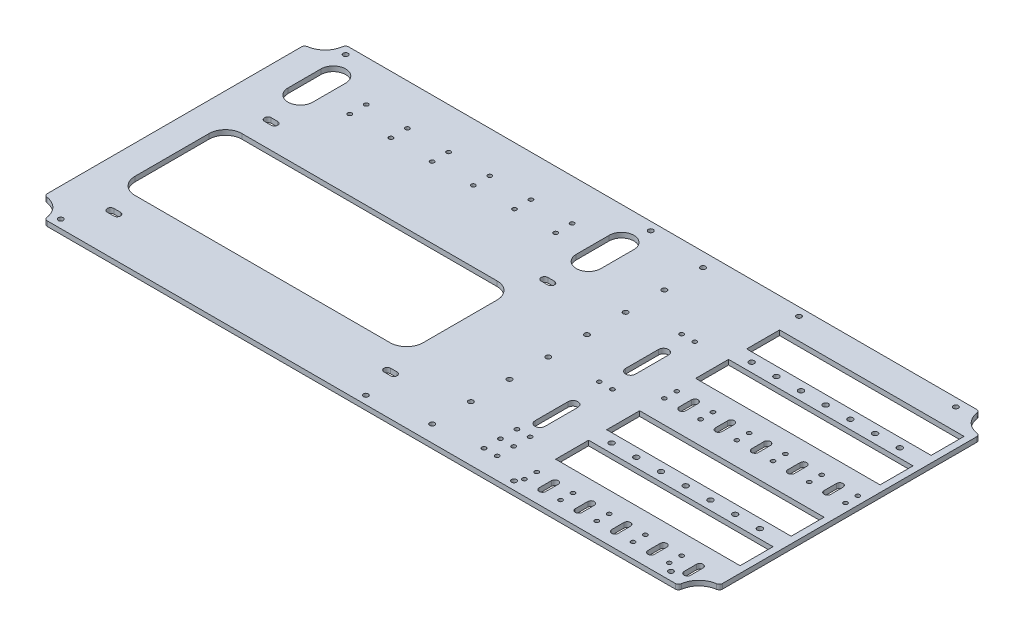
from build123d import *

# Parameters (mm, degrees)
BOSS_EXTRUDE1_DEPTH = 3
CUT_EXTRUDE1_REACH  = 450.997
SKETCH2_R           = 1.6
SKETCH2_W           = 112
SKETCH2_H           = 20
CUT_EXTRUDE2_REACH  = 450.997
SKETCH3_R           = 1.5
CUT_EXTRUDE3_REACH  = 450.997
SKETCH4_R           = 1.25
SKETCH8_R           = 1.25
CUT_EXTRUDE4_DEPTH  = 3
CUT_EXTRUDE5_REACH  = 450.997
SKETCH9_R           = 1.25
CUT_EXTRUDE6_REACH  = 450.997
SKETCH10_R          = 1.5
CUT_EXTRUDE7_REACH  = 450.997
CUT_EXTRUDE8_REACH  = 450.997


with BuildPart() as part:
    # Sketch1 → Boss-Extrude1 (new body)
    with BuildSketch(Plane(origin=(0, 0, 0), x_dir=(1, 0, 0), z_dir=(0, 1, 0))):
        with BuildLine():
            Line((0, 14.361406616), (0, 168.638593384))
            ThreePointArc((0, 168.638593384), (0.491403941, 169.951657712), (1.724137931, 170.619477055))
            ThreePointArc((1.724137931, 170.619477055), (8.838834765, 174.161165235), (12.380522945, 181.275862069))
            ThreePointArc((12.380522945, 181.275862069), (13.048342288, 182.508596059), (14.361406616, 183))
            Line((14.361406616, 183), (395.638593384, 183))
            ThreePointArc((395.638593384, 183), (396.951657712, 182.508596059), (397.619477055, 181.275862069))
            ThreePointArc((397.619477055, 181.275862069), (401.161165235, 174.161165235), (408.275862069, 170.619477055))
            ThreePointArc((408.275862069, 170.619477055), (409.508596059, 169.951657712), (410, 168.638593384))
            Line((410, 168.638593384), (410, 14.361406616))
            ThreePointArc((410, 14.361406616), (409.508596059, 13.048342288), (408.275862069, 12.380522945))
            ThreePointArc((408.275862069, 12.380522945), (401.161165235, 8.838834765), (397.619477055, 1.724137931))
            ThreePointArc((397.619477055, 1.724137931), (396.951657712, 0.491403941), (395.638593384, 0))
            Line((395.638593384, 0), (14.361406616, 0))
            ThreePointArc((14.361406616, 0), (13.048342288, 0.491403941), (12.380522945, 1.724137931))
            ThreePointArc((12.380522945, 1.724137931), (8.838834765, 8.838834765), (1.724137931, 12.380522945))
            ThreePointArc((1.724137931, 12.380522945), (0.491403941, 13.048342288), (0, 14.361406616))
        make_face()
    extrude(amount=BOSS_EXTRUDE1_DEPTH)

    # Sketch2 → Cut-Extrude1 (cut, up to next)
    with BuildSketch(Plane(origin=(0, 3, 0), x_dir=(1, 0, 0), z_dir=(0, 1, 0)), mode=Mode.PRIVATE) as cut_extrude1_sk1:
        with Locations(Location((302.5, 139.5, 0), (0, 0, 270))):
            Circle(SKETCH2_R)
    cut_extrude1_tool1 = extrude(cut_extrude1_sk1.sketch, amount=-CUT_EXTRUDE1_REACH, mode=Mode.PRIVATE) & part.part
    # Sketch2 → Cut-Extrude1 (cut, up to next)
    with BuildSketch(Plane(origin=(0, 3, 0), x_dir=(1, 0, 0), z_dir=(0, 1, 0)), mode=Mode.PRIVATE) as cut_extrude1_sk2:
        with Locations(Location((317.5, 139.5, 0), (0, 0, 270))):
            Circle(SKETCH2_R)
    cut_extrude1_tool2 = extrude(cut_extrude1_sk2.sketch, amount=-CUT_EXTRUDE1_REACH, mode=Mode.PRIVATE) & part.part
    # Sketch2 → Cut-Extrude1 (cut, up to next)
    with BuildSketch(Plane(origin=(0, 3, 0), x_dir=(1, 0, 0), z_dir=(0, 1, 0)), mode=Mode.PRIVATE) as cut_extrude1_sk3:
        with Locations(Location((332.5, 139.5, 0), (0, 0, 270))):
            Circle(SKETCH2_R)
    cut_extrude1_tool3 = extrude(cut_extrude1_sk3.sketch, amount=-CUT_EXTRUDE1_REACH, mode=Mode.PRIVATE) & part.part
    # Sketch2 → Cut-Extrude1 (cut, up to next)
    with BuildSketch(Plane(origin=(0, 3, 0), x_dir=(1, 0, 0), z_dir=(0, 1, 0)), mode=Mode.PRIVATE) as cut_extrude1_sk4:
        with Locations(Location((347.5, 139.5, 0), (0, 0, 270))):
            Circle(SKETCH2_R)
    cut_extrude1_tool4 = extrude(cut_extrude1_sk4.sketch, amount=-CUT_EXTRUDE1_REACH, mode=Mode.PRIVATE) & part.part
    # Sketch2 → Cut-Extrude1 (cut, up to next)
    with BuildSketch(Plane(origin=(0, 3, 0), x_dir=(1, 0, 0), z_dir=(0, 1, 0)), mode=Mode.PRIVATE) as cut_extrude1_sk5:
        with Locations(Location((362.5, 139.5, 0), (0, 0, 270))):
            Circle(SKETCH2_R)
    cut_extrude1_tool5 = extrude(cut_extrude1_sk5.sketch, amount=-CUT_EXTRUDE1_REACH, mode=Mode.PRIVATE) & part.part
    # Sketch2 → Cut-Extrude1 (cut, up to next)
    with BuildSketch(Plane(origin=(0, 3, 0), x_dir=(1, 0, 0), z_dir=(0, 1, 0)), mode=Mode.PRIVATE) as cut_extrude1_sk6:
        with Locations(Location((377.5, 139.5, 0), (0, 0, 270))):
            Circle(SKETCH2_R)
    cut_extrude1_tool6 = extrude(cut_extrude1_sk6.sketch, amount=-CUT_EXTRUDE1_REACH, mode=Mode.PRIVATE) & part.part
    # Sketch2 → Cut-Extrude1 (cut, up to next)
    with BuildSketch(Plane(origin=(0, 3, 0), x_dir=(1, 0, 0), z_dir=(0, 1, 0)), mode=Mode.PRIVATE) as cut_extrude1_sk7:
        with Locations(Location((392.5, 139.5, 0), (0, 0, 270))):
            Circle(SKETCH2_R)
    cut_extrude1_tool7 = extrude(cut_extrude1_sk7.sketch, amount=-CUT_EXTRUDE1_REACH, mode=Mode.PRIVATE) & part.part
    # Sketch2 → Cut-Extrude1 (cut, up to next)
    with BuildSketch(Plane(origin=(0, 3, 0), x_dir=(1, 0, 0), z_dir=(0, 1, 0)), mode=Mode.PRIVATE) as cut_extrude1_sk8:
        with Locations(Location((302.5, 54.5, 0), (0, 0, 270))):
            Circle(SKETCH2_R)
    cut_extrude1_tool8 = extrude(cut_extrude1_sk8.sketch, amount=-CUT_EXTRUDE1_REACH, mode=Mode.PRIVATE) & part.part
    # Sketch2 → Cut-Extrude1 (cut, up to next)
    with BuildSketch(Plane(origin=(0, 3, 0), x_dir=(1, 0, 0), z_dir=(0, 1, 0)), mode=Mode.PRIVATE) as cut_extrude1_sk9:
        with Locations(Location((317.5, 54.5, 0), (0, 0, 270))):
            Circle(SKETCH2_R)
    cut_extrude1_tool9 = extrude(cut_extrude1_sk9.sketch, amount=-CUT_EXTRUDE1_REACH, mode=Mode.PRIVATE) & part.part
    # Sketch2 → Cut-Extrude1 (cut, up to next)
    with BuildSketch(Plane(origin=(0, 3, 0), x_dir=(1, 0, 0), z_dir=(0, 1, 0)), mode=Mode.PRIVATE) as cut_extrude1_sk10:
        with Locations(Location((332.5, 54.5, 0), (0, 0, 270))):
            Circle(SKETCH2_R)
    cut_extrude1_tool10 = extrude(cut_extrude1_sk10.sketch, amount=-CUT_EXTRUDE1_REACH, mode=Mode.PRIVATE) & part.part
    # Sketch2 → Cut-Extrude1 (cut, up to next)
    with BuildSketch(Plane(origin=(0, 3, 0), x_dir=(1, 0, 0), z_dir=(0, 1, 0)), mode=Mode.PRIVATE) as cut_extrude1_sk11:
        with Locations(Location((347.5, 54.5, 0), (0, 0, 270))):
            Circle(SKETCH2_R)
    cut_extrude1_tool11 = extrude(cut_extrude1_sk11.sketch, amount=-CUT_EXTRUDE1_REACH, mode=Mode.PRIVATE) & part.part
    # Sketch2 → Cut-Extrude1 (cut, up to next)
    with BuildSketch(Plane(origin=(0, 3, 0), x_dir=(1, 0, 0), z_dir=(0, 1, 0)), mode=Mode.PRIVATE) as cut_extrude1_sk12:
        with Locations(Location((362.5, 54.5, 0), (0, 0, 270))):
            Circle(SKETCH2_R)
    cut_extrude1_tool12 = extrude(cut_extrude1_sk12.sketch, amount=-CUT_EXTRUDE1_REACH, mode=Mode.PRIVATE) & part.part
    # Sketch2 → Cut-Extrude1 (cut, up to next)
    with BuildSketch(Plane(origin=(0, 3, 0), x_dir=(1, 0, 0), z_dir=(0, 1, 0)), mode=Mode.PRIVATE) as cut_extrude1_sk13:
        with Locations(Location((377.5, 54.5, 0), (0, 0, 270))):
            Circle(SKETCH2_R)
    cut_extrude1_tool13 = extrude(cut_extrude1_sk13.sketch, amount=-CUT_EXTRUDE1_REACH, mode=Mode.PRIVATE) & part.part
    # Sketch2 → Cut-Extrude1 (cut, up to next)
    with BuildSketch(Plane(origin=(0, 3, 0), x_dir=(1, 0, 0), z_dir=(0, 1, 0)), mode=Mode.PRIVATE) as cut_extrude1_sk14:
        with Locations(Location((392.5, 54.5, 0), (0, 0, 270))):
            Circle(SKETCH2_R)
    cut_extrude1_tool14 = extrude(cut_extrude1_sk14.sketch, amount=-CUT_EXTRUDE1_REACH, mode=Mode.PRIVATE) & part.part
    # Sketch2 → Cut-Extrude1 (cut, up to next)
    with BuildSketch(Plane(origin=(0, 3, 0), x_dir=(1, 0, 0), z_dir=(0, 1, 0)), mode=Mode.PRIVATE) as cut_extrude1_sk15:
        with Locations((350, 155)):
            Rectangle(SKETCH2_W, SKETCH2_H)
    cut_extrude1_tool15 = extrude(cut_extrude1_sk15.sketch, amount=-CUT_EXTRUDE1_REACH, mode=Mode.PRIVATE) & part.part
    # Sketch2 → Cut-Extrude1 (cut, up to next)
    with BuildSketch(Plane(origin=(0, 3, 0), x_dir=(1, 0, 0), z_dir=(0, 1, 0)), mode=Mode.PRIVATE) as cut_extrude1_sk16:
        with Locations((350, 124)):
            Rectangle(SKETCH2_W, SKETCH2_H)
    cut_extrude1_tool16 = extrude(cut_extrude1_sk16.sketch, amount=-CUT_EXTRUDE1_REACH, mode=Mode.PRIVATE) & part.part
    # Sketch2 → Cut-Extrude1 (cut, up to next)
    with BuildSketch(Plane(origin=(0, 3, 0), x_dir=(1, 0, 0), z_dir=(0, 1, 0)), mode=Mode.PRIVATE) as cut_extrude1_sk17:
        with Locations((350, 70)):
            Rectangle(SKETCH2_W, SKETCH2_H)
    cut_extrude1_tool17 = extrude(cut_extrude1_sk17.sketch, amount=-CUT_EXTRUDE1_REACH, mode=Mode.PRIVATE) & part.part
    # Sketch2 → Cut-Extrude1 (cut, up to next)
    with BuildSketch(Plane(origin=(0, 3, 0), x_dir=(1, 0, 0), z_dir=(0, 1, 0)), mode=Mode.PRIVATE) as cut_extrude1_sk18:
        with Locations((350, 39)):
            Rectangle(SKETCH2_W, SKETCH2_H)
    cut_extrude1_tool18 = extrude(cut_extrude1_sk18.sketch, amount=-CUT_EXTRUDE1_REACH, mode=Mode.PRIVATE) & part.part
    add(cut_extrude1_tool1.solids().sort_by_distance((302.5, 3, -139.5))[0], mode=Mode.SUBTRACT)
    add(cut_extrude1_tool2.solids().sort_by_distance((317.5, 3, -139.5))[0], mode=Mode.SUBTRACT)
    add(cut_extrude1_tool3.solids().sort_by_distance((332.5, 3, -139.5))[0], mode=Mode.SUBTRACT)
    add(cut_extrude1_tool4.solids().sort_by_distance((347.5, 3, -139.5))[0], mode=Mode.SUBTRACT)
    add(cut_extrude1_tool5.solids().sort_by_distance((362.5, 3, -139.5))[0], mode=Mode.SUBTRACT)
    add(cut_extrude1_tool6.solids().sort_by_distance((377.5, 3, -139.5))[0], mode=Mode.SUBTRACT)
    add(cut_extrude1_tool7.solids().sort_by_distance((392.5, 3, -139.5))[0], mode=Mode.SUBTRACT)
    add(cut_extrude1_tool8.solids().sort_by_distance((302.5, 3, -54.5))[0], mode=Mode.SUBTRACT)
    add(cut_extrude1_tool9.solids().sort_by_distance((317.5, 3, -54.5))[0], mode=Mode.SUBTRACT)
    add(cut_extrude1_tool10.solids().sort_by_distance((332.5, 3, -54.5))[0], mode=Mode.SUBTRACT)
    add(cut_extrude1_tool11.solids().sort_by_distance((347.5, 3, -54.5))[0], mode=Mode.SUBTRACT)
    add(cut_extrude1_tool12.solids().sort_by_distance((362.5, 3, -54.5))[0], mode=Mode.SUBTRACT)
    add(cut_extrude1_tool13.solids().sort_by_distance((377.5, 3, -54.5))[0], mode=Mode.SUBTRACT)
    add(cut_extrude1_tool14.solids().sort_by_distance((392.5, 3, -54.5))[0], mode=Mode.SUBTRACT)
    add(cut_extrude1_tool15.solids().sort_by_distance((350, 3, -155))[0], mode=Mode.SUBTRACT)
    add(cut_extrude1_tool16.solids().sort_by_distance((350, 3, -124))[0], mode=Mode.SUBTRACT)
    add(cut_extrude1_tool17.solids().sort_by_distance((350, 3, -70))[0], mode=Mode.SUBTRACT)
    add(cut_extrude1_tool18.solids().sort_by_distance((350, 3, -39))[0], mode=Mode.SUBTRACT)

    # Sketch3 → Cut-Extrude2 (cut, up to next)
    with BuildSketch(Plane(origin=(0, 3, 0), x_dir=(1, 0, 0), z_dir=(0, 1, 0)), mode=Mode.PRIVATE) as cut_extrude2_sk1:
        with Locations(Location((238, 10, 0), (0, 0, 270))):
            Circle(SKETCH3_R)
    cut_extrude2_tool1 = extrude(cut_extrude2_sk1.sketch, amount=-CUT_EXTRUDE2_REACH, mode=Mode.PRIVATE) & part.part
    # Sketch3 → Cut-Extrude2 (cut, up to next)
    with BuildSketch(Plane(origin=(0, 3, 0), x_dir=(1, 0, 0), z_dir=(0, 1, 0)), mode=Mode.PRIVATE) as cut_extrude2_sk2:
        with Locations(Location((238, 33.5, 0), (0, 0, 270))):
            Circle(SKETCH3_R)
    cut_extrude2_tool2 = extrude(cut_extrude2_sk2.sketch, amount=-CUT_EXTRUDE2_REACH, mode=Mode.PRIVATE) & part.part
    # Sketch3 → Cut-Extrude2 (cut, up to next)
    with BuildSketch(Plane(origin=(0, 3, 0), x_dir=(1, 0, 0), z_dir=(0, 1, 0)), mode=Mode.PRIVATE) as cut_extrude2_sk3:
        with Locations(Location((238, 57, 0), (0, 0, 270))):
            Circle(SKETCH3_R)
    cut_extrude2_tool3 = extrude(cut_extrude2_sk3.sketch, amount=-CUT_EXTRUDE2_REACH, mode=Mode.PRIVATE) & part.part
    # Sketch3 → Cut-Extrude2 (cut, up to next)
    with BuildSketch(Plane(origin=(0, 3, 0), x_dir=(1, 0, 0), z_dir=(0, 1, 0)), mode=Mode.PRIVATE) as cut_extrude2_sk4:
        with Locations(Location((238, 80.5, 0), (0, 0, 270))):
            Circle(SKETCH3_R)
    cut_extrude2_tool4 = extrude(cut_extrude2_sk4.sketch, amount=-CUT_EXTRUDE2_REACH, mode=Mode.PRIVATE) & part.part
    # Sketch3 → Cut-Extrude2 (cut, up to next)
    with BuildSketch(Plane(origin=(0, 3, 0), x_dir=(1, 0, 0), z_dir=(0, 1, 0)), mode=Mode.PRIVATE) as cut_extrude2_sk5:
        with Locations(Location((238, 104, 0), (0, 0, 270))):
            Circle(SKETCH3_R)
    cut_extrude2_tool5 = extrude(cut_extrude2_sk5.sketch, amount=-CUT_EXTRUDE2_REACH, mode=Mode.PRIVATE) & part.part
    # Sketch3 → Cut-Extrude2 (cut, up to next)
    with BuildSketch(Plane(origin=(0, 3, 0), x_dir=(1, 0, 0), z_dir=(0, 1, 0)), mode=Mode.PRIVATE) as cut_extrude2_sk6:
        with Locations(Location((238, 127.5, 0), (0, 0, 270))):
            Circle(SKETCH3_R)
    cut_extrude2_tool6 = extrude(cut_extrude2_sk6.sketch, amount=-CUT_EXTRUDE2_REACH, mode=Mode.PRIVATE) & part.part
    # Sketch3 → Cut-Extrude2 (cut, up to next)
    with BuildSketch(Plane(origin=(0, 3, 0), x_dir=(1, 0, 0), z_dir=(0, 1, 0)), mode=Mode.PRIVATE) as cut_extrude2_sk7:
        with Locations(Location((238, 151, 0), (0, 0, 270))):
            Circle(SKETCH3_R)
    cut_extrude2_tool7 = extrude(cut_extrude2_sk7.sketch, amount=-CUT_EXTRUDE2_REACH, mode=Mode.PRIVATE) & part.part
    # Sketch3 → Cut-Extrude2 (cut, up to next)
    with BuildSketch(Plane(origin=(0, 3, 0), x_dir=(1, 0, 0), z_dir=(0, 1, 0)), mode=Mode.PRIVATE) as cut_extrude2_sk8:
        with Locations(Location((238, 174.5, 0), (0, 0, 270))):
            Circle(SKETCH3_R)
    cut_extrude2_tool8 = extrude(cut_extrude2_sk8.sketch, amount=-CUT_EXTRUDE2_REACH, mode=Mode.PRIVATE) & part.part
    add(cut_extrude2_tool1.solids().sort_by_distance((238, 3, -10))[0], mode=Mode.SUBTRACT)
    add(cut_extrude2_tool2.solids().sort_by_distance((238, 3, -33.5))[0], mode=Mode.SUBTRACT)
    add(cut_extrude2_tool3.solids().sort_by_distance((238, 3, -57))[0], mode=Mode.SUBTRACT)
    add(cut_extrude2_tool4.solids().sort_by_distance((238, 3, -80.5))[0], mode=Mode.SUBTRACT)
    add(cut_extrude2_tool5.solids().sort_by_distance((238, 3, -104))[0], mode=Mode.SUBTRACT)
    add(cut_extrude2_tool6.solids().sort_by_distance((238, 3, -127.5))[0], mode=Mode.SUBTRACT)
    add(cut_extrude2_tool7.solids().sort_by_distance((238, 3, -151))[0], mode=Mode.SUBTRACT)
    add(cut_extrude2_tool8.solids().sort_by_distance((238, 3, -174.5))[0], mode=Mode.SUBTRACT)

    # Sketch4 → Cut-Extrude3 (cut, up to next)
    with BuildSketch(Plane(origin=(0, 3, 0), x_dir=(1, 0, 0), z_dir=(0, 1, 0)), mode=Mode.PRIVATE) as cut_extrude3_sk1:
        with Locations(Location((50, 158, 0), (0, 0, 270))):
            Circle(SKETCH4_R)
    cut_extrude3_tool1 = extrude(cut_extrude3_sk1.sketch, amount=-CUT_EXTRUDE3_REACH, mode=Mode.PRIVATE) & part.part
    # Sketch4 → Cut-Extrude3 (cut, up to next)
    with BuildSketch(Plane(origin=(0, 3, 0), x_dir=(1, 0, 0), z_dir=(0, 1, 0)), mode=Mode.PRIVATE) as cut_extrude3_sk2:
        with Locations(Location((75, 158, 0), (0, 0, 270))):
            Circle(SKETCH4_R)
    cut_extrude3_tool2 = extrude(cut_extrude3_sk2.sketch, amount=-CUT_EXTRUDE3_REACH, mode=Mode.PRIVATE) & part.part
    # Sketch4 → Cut-Extrude3 (cut, up to next)
    with BuildSketch(Plane(origin=(0, 3, 0), x_dir=(1, 0, 0), z_dir=(0, 1, 0)), mode=Mode.PRIVATE) as cut_extrude3_sk3:
        with Locations(Location((100, 158, 0), (0, 0, 270))):
            Circle(SKETCH4_R)
    cut_extrude3_tool3 = extrude(cut_extrude3_sk3.sketch, amount=-CUT_EXTRUDE3_REACH, mode=Mode.PRIVATE) & part.part
    # Sketch4 → Cut-Extrude3 (cut, up to next)
    with BuildSketch(Plane(origin=(0, 3, 0), x_dir=(1, 0, 0), z_dir=(0, 1, 0)), mode=Mode.PRIVATE) as cut_extrude3_sk4:
        with Locations(Location((125, 158, 0), (0, 0, 270))):
            Circle(SKETCH4_R)
    cut_extrude3_tool4 = extrude(cut_extrude3_sk4.sketch, amount=-CUT_EXTRUDE3_REACH, mode=Mode.PRIVATE) & part.part
    # Sketch4 → Cut-Extrude3 (cut, up to next)
    with BuildSketch(Plane(origin=(0, 3, 0), x_dir=(1, 0, 0), z_dir=(0, 1, 0)), mode=Mode.PRIVATE) as cut_extrude3_sk5:
        with Locations(Location((150, 158, 0), (0, 0, 270))):
            Circle(SKETCH4_R)
    cut_extrude3_tool5 = extrude(cut_extrude3_sk5.sketch, amount=-CUT_EXTRUDE3_REACH, mode=Mode.PRIVATE) & part.part
    # Sketch4 → Cut-Extrude3 (cut, up to next)
    with BuildSketch(Plane(origin=(0, 3, 0), x_dir=(1, 0, 0), z_dir=(0, 1, 0)), mode=Mode.PRIVATE) as cut_extrude3_sk6:
        with Locations(Location((175, 158, 0), (0, 0, 270))):
            Circle(SKETCH4_R)
    cut_extrude3_tool6 = extrude(cut_extrude3_sk6.sketch, amount=-CUT_EXTRUDE3_REACH, mode=Mode.PRIVATE) & part.part
    # Sketch4 → Cut-Extrude3 (cut, up to next)
    with BuildSketch(Plane(origin=(0, 3, 0), x_dir=(1, 0, 0), z_dir=(0, 1, 0)), mode=Mode.PRIVATE) as cut_extrude3_sk7:
        with Locations(Location((175, 148, 0), (0, 0, 270))):
            Circle(SKETCH4_R)
    cut_extrude3_tool7 = extrude(cut_extrude3_sk7.sketch, amount=-CUT_EXTRUDE3_REACH, mode=Mode.PRIVATE) & part.part
    # Sketch4 → Cut-Extrude3 (cut, up to next)
    with BuildSketch(Plane(origin=(0, 3, 0), x_dir=(1, 0, 0), z_dir=(0, 1, 0)), mode=Mode.PRIVATE) as cut_extrude3_sk8:
        with Locations(Location((150, 148, 0), (0, 0, 270))):
            Circle(SKETCH4_R)
    cut_extrude3_tool8 = extrude(cut_extrude3_sk8.sketch, amount=-CUT_EXTRUDE3_REACH, mode=Mode.PRIVATE) & part.part
    # Sketch4 → Cut-Extrude3 (cut, up to next)
    with BuildSketch(Plane(origin=(0, 3, 0), x_dir=(1, 0, 0), z_dir=(0, 1, 0)), mode=Mode.PRIVATE) as cut_extrude3_sk9:
        with Locations(Location((125, 148, 0), (0, 0, 270))):
            Circle(SKETCH4_R)
    cut_extrude3_tool9 = extrude(cut_extrude3_sk9.sketch, amount=-CUT_EXTRUDE3_REACH, mode=Mode.PRIVATE) & part.part
    # Sketch4 → Cut-Extrude3 (cut, up to next)
    with BuildSketch(Plane(origin=(0, 3, 0), x_dir=(1, 0, 0), z_dir=(0, 1, 0)), mode=Mode.PRIVATE) as cut_extrude3_sk10:
        with Locations(Location((100, 148, 0), (0, 0, 270))):
            Circle(SKETCH4_R)
    cut_extrude3_tool10 = extrude(cut_extrude3_sk10.sketch, amount=-CUT_EXTRUDE3_REACH, mode=Mode.PRIVATE) & part.part
    # Sketch4 → Cut-Extrude3 (cut, up to next)
    with BuildSketch(Plane(origin=(0, 3, 0), x_dir=(1, 0, 0), z_dir=(0, 1, 0)), mode=Mode.PRIVATE) as cut_extrude3_sk11:
        with Locations(Location((75, 148, 0), (0, 0, 270))):
            Circle(SKETCH4_R)
    cut_extrude3_tool11 = extrude(cut_extrude3_sk11.sketch, amount=-CUT_EXTRUDE3_REACH, mode=Mode.PRIVATE) & part.part
    # Sketch4 → Cut-Extrude3 (cut, up to next)
    with BuildSketch(Plane(origin=(0, 3, 0), x_dir=(1, 0, 0), z_dir=(0, 1, 0)), mode=Mode.PRIVATE) as cut_extrude3_sk12:
        with Locations(Location((50, 148, 0), (0, 0, 270))):
            Circle(SKETCH4_R)
    cut_extrude3_tool12 = extrude(cut_extrude3_sk12.sketch, amount=-CUT_EXTRUDE3_REACH, mode=Mode.PRIVATE) & part.part
    # Sketch4 → Cut-Extrude3 (cut, up to next)
    with BuildSketch(Plane(origin=(0, 3, 0), x_dir=(1, 0, 0), z_dir=(0, 1, 0)), mode=Mode.PRIVATE) as cut_extrude3_sk13:
        with BuildLine():
            Line((17.5, 143), (17.5, 163))
            ThreePointArc((17.5, 163), (25, 170.5), (32.5, 163))
            Line((32.5, 163), (32.5, 143))
            ThreePointArc((32.5, 143), (25, 135.5), (17.5, 143))
        make_face()
    cut_extrude3_tool13 = extrude(cut_extrude3_sk13.sketch, amount=-CUT_EXTRUDE3_REACH, mode=Mode.PRIVATE) & part.part
    # Sketch4 → Cut-Extrude3 (cut, up to next)
    with BuildSketch(Plane(origin=(0, 3, 0), x_dir=(1, 0, 0), z_dir=(0, 1, 0)), mode=Mode.PRIVATE) as cut_extrude3_sk14:
        with BuildLine():
            Line((192.5, 143), (192.5, 163))
            ThreePointArc((192.5, 163), (200, 170.5), (207.5, 163))
            Line((207.5, 163), (207.5, 143))
            ThreePointArc((207.5, 143), (200, 135.5), (192.5, 143))
        make_face()
    cut_extrude3_tool14 = extrude(cut_extrude3_sk14.sketch, amount=-CUT_EXTRUDE3_REACH, mode=Mode.PRIVATE) & part.part
    add(cut_extrude3_tool1.solids().sort_by_distance((50, 3, -158))[0], mode=Mode.SUBTRACT)
    add(cut_extrude3_tool2.solids().sort_by_distance((75, 3, -158))[0], mode=Mode.SUBTRACT)
    add(cut_extrude3_tool3.solids().sort_by_distance((100, 3, -158))[0], mode=Mode.SUBTRACT)
    add(cut_extrude3_tool4.solids().sort_by_distance((125, 3, -158))[0], mode=Mode.SUBTRACT)
    add(cut_extrude3_tool5.solids().sort_by_distance((150, 3, -158))[0], mode=Mode.SUBTRACT)
    add(cut_extrude3_tool6.solids().sort_by_distance((175, 3, -158))[0], mode=Mode.SUBTRACT)
    add(cut_extrude3_tool7.solids().sort_by_distance((175, 3, -148))[0], mode=Mode.SUBTRACT)
    add(cut_extrude3_tool8.solids().sort_by_distance((150, 3, -148))[0], mode=Mode.SUBTRACT)
    add(cut_extrude3_tool9.solids().sort_by_distance((125, 3, -148))[0], mode=Mode.SUBTRACT)
    add(cut_extrude3_tool10.solids().sort_by_distance((100, 3, -148))[0], mode=Mode.SUBTRACT)
    add(cut_extrude3_tool11.solids().sort_by_distance((75, 3, -148))[0], mode=Mode.SUBTRACT)
    add(cut_extrude3_tool12.solids().sort_by_distance((50, 3, -148))[0], mode=Mode.SUBTRACT)
    add(cut_extrude3_tool13.solids().sort_by_distance((25, 3, -153))[0], mode=Mode.SUBTRACT)
    add(cut_extrude3_tool14.solids().sort_by_distance((200, 3, -153))[0], mode=Mode.SUBTRACT)

    # Sketch8 → Cut-Extrude4 (cut)
    with BuildSketch(Plane(origin=(0, 3, 0), x_dir=(1, 0, 0), z_dir=(0, 1, 0))):
        with Locations(Location((405, 94, 0), (0, 0, 270))):
            Circle(SKETCH8_R)
        with Locations(Location((383, 94, 0), (0, 0, 270))):
            Circle(SKETCH8_R)
        with Locations(Location((361, 94, 0), (0, 0, 270))):
            Circle(SKETCH8_R)
        with Locations(Location((339, 94, 0), (0, 0, 270))):
            Circle(SKETCH8_R)
        with Locations(Location((317, 94, 0), (0, 0, 270))):
            Circle(SKETCH8_R)
        with Locations(Location((295, 94, 0), (0, 0, 270))):
            Circle(SKETCH8_R)
        with Locations(Location((405, 101.5, 0), (0, 0, 270))):
            Circle(SKETCH8_R)
        with Locations(Location((383, 101.5, 0), (0, 0, 270))):
            Circle(SKETCH8_R)
        with Locations(Location((361, 101.5, 0), (0, 0, 270))):
            Circle(SKETCH8_R)
        with Locations(Location((339, 101.5, 0), (0, 0, 270))):
            Circle(SKETCH8_R)
        with Locations(Location((317, 101.5, 0), (0, 0, 270))):
            Circle(SKETCH8_R)
        with Locations(Location((295, 101.5, 0), (0, 0, 270))):
            Circle(SKETCH8_R)
        with Locations(Location((383, 9, 0), (0, 0, 270))):
            Circle(SKETCH8_R)
        with Locations(Location((361, 9, 0), (0, 0, 270))):
            Circle(SKETCH8_R)
        with Locations(Location((339, 9, 0), (0, 0, 270))):
            Circle(SKETCH8_R)
        with Locations(Location((317, 9, 0), (0, 0, 270))):
            Circle(SKETCH8_R)
        with Locations(Location((295, 9, 0), (0, 0, 270))):
            Circle(SKETCH8_R)
        with Locations(Location((383, 16.5, 0), (0, 0, 270))):
            Circle(SKETCH8_R)
        with Locations(Location((361, 16.5, 0), (0, 0, 270))):
            Circle(SKETCH8_R)
        with Locations(Location((339, 16.5, 0), (0, 0, 270))):
            Circle(SKETCH8_R)
        with Locations(Location((317, 16.5, 0), (0, 0, 270))):
            Circle(SKETCH8_R)
        with Locations(Location((295, 16.5, 0), (0, 0, 270))):
            Circle(SKETCH8_R)
        with BuildLine():
            Line((396, 101.5), (396, 94))
            ThreePointArc((396, 94), (394, 92), (392, 94))
            Line((392, 94), (392, 101.5))
            ThreePointArc((392, 101.5), (394, 103.5), (396, 101.5))
        make_face()
        with BuildLine():
            Line((374, 101.5), (374, 94))
            ThreePointArc((374, 94), (372, 92), (370, 94))
            Line((370, 94), (370, 101.5))
            ThreePointArc((370, 101.5), (372, 103.5), (374, 101.5))
        make_face()
        with BuildLine():
            Line((352, 101.5), (352, 94))
            ThreePointArc((352, 94), (350, 92), (348, 94))
            Line((348, 94), (348, 101.5))
            ThreePointArc((348, 101.5), (350, 103.5), (352, 101.5))
        make_face()
        with BuildLine():
            Line((330, 101.5), (330, 94))
            ThreePointArc((330, 94), (328, 92), (326, 94))
            Line((326, 94), (326, 101.5))
            ThreePointArc((326, 101.5), (328, 103.5), (330, 101.5))
        make_face()
        with BuildLine():
            Line((308, 101.5), (308, 94))
            ThreePointArc((308, 94), (306, 92), (304, 94))
            Line((304, 94), (304, 101.5))
            ThreePointArc((304, 101.5), (306, 103.5), (308, 101.5))
        make_face()
        with BuildLine():
            Line((396, 16.5), (396, 9))
            ThreePointArc((396, 9), (394, 7), (392, 9))
            Line((392, 9), (392, 16.5))
            ThreePointArc((392, 16.5), (394, 18.5), (396, 16.5))
        make_face()
        with BuildLine():
            Line((374, 16.5), (374, 9))
            ThreePointArc((374, 9), (372, 7), (370, 9))
            Line((370, 9), (370, 16.5))
            ThreePointArc((370, 16.5), (372, 18.5), (374, 16.5))
        make_face()
        with BuildLine():
            Line((352, 16.5), (352, 9))
            ThreePointArc((352, 9), (350, 7), (348, 9))
            Line((348, 9), (348, 16.5))
            ThreePointArc((348, 16.5), (350, 18.5), (352, 16.5))
        make_face()
        with BuildLine():
            Line((330, 16.5), (330, 9))
            ThreePointArc((330, 9), (328, 7), (326, 9))
            Line((326, 9), (326, 16.5))
            ThreePointArc((326, 16.5), (328, 18.5), (330, 16.5))
        make_face()
        with BuildLine():
            Line((308, 16.5), (308, 9))
            ThreePointArc((308, 9), (306, 7), (304, 9))
            Line((304, 9), (304, 16.5))
            ThreePointArc((304, 16.5), (306, 18.5), (308, 16.5))
        make_face()
    extrude(amount=-CUT_EXTRUDE4_DEPTH, mode=Mode.SUBTRACT)

    # Sketch9 → Cut-Extrude5 (cut, up to next)
    with BuildSketch(Plane(origin=(0, 3, 0), x_dir=(1, 0, 0), z_dir=(0, 1, 0)), mode=Mode.PRIVATE) as cut_extrude5_sk1:
        with Locations(Location((274.5, 133, 0), (0, 0, 270))):
            Circle(SKETCH9_R)
    cut_extrude5_tool1 = extrude(cut_extrude5_sk1.sketch, amount=-CUT_EXTRUDE5_REACH, mode=Mode.PRIVATE) & part.part
    # Sketch9 → Cut-Extrude5 (cut, up to next)
    with BuildSketch(Plane(origin=(0, 3, 0), x_dir=(1, 0, 0), z_dir=(0, 1, 0)), mode=Mode.PRIVATE) as cut_extrude5_sk2:
        with Locations(Location((274.5, 83, 0), (0, 0, 270))):
            Circle(SKETCH9_R)
    cut_extrude5_tool2 = extrude(cut_extrude5_sk2.sketch, amount=-CUT_EXTRUDE5_REACH, mode=Mode.PRIVATE) & part.part
    # Sketch9 → Cut-Extrude5 (cut, up to next)
    with BuildSketch(Plane(origin=(0, 3, 0), x_dir=(1, 0, 0), z_dir=(0, 1, 0)), mode=Mode.PRIVATE) as cut_extrude5_sk3:
        with Locations(Location((274.5, 33, 0), (0, 0, 270))):
            Circle(SKETCH9_R)
    cut_extrude5_tool3 = extrude(cut_extrude5_sk3.sketch, amount=-CUT_EXTRUDE5_REACH, mode=Mode.PRIVATE) & part.part
    # Sketch9 → Cut-Extrude5 (cut, up to next)
    with BuildSketch(Plane(origin=(0, 3, 0), x_dir=(1, 0, 0), z_dir=(0, 1, 0)), mode=Mode.PRIVATE) as cut_extrude5_sk4:
        with Locations(Location((274.5, 23, 0), (0, 0, 270))):
            Circle(SKETCH9_R)
    cut_extrude5_tool4 = extrude(cut_extrude5_sk4.sketch, amount=-CUT_EXTRUDE5_REACH, mode=Mode.PRIVATE) & part.part
    # Sketch9 → Cut-Extrude5 (cut, up to next)
    with BuildSketch(Plane(origin=(0, 3, 0), x_dir=(1, 0, 0), z_dir=(0, 1, 0)), mode=Mode.PRIVATE) as cut_extrude5_sk5:
        with Locations(Location((274.5, 13, 0), (0, 0, 270))):
            Circle(SKETCH9_R)
    cut_extrude5_tool5 = extrude(cut_extrude5_sk5.sketch, amount=-CUT_EXTRUDE5_REACH, mode=Mode.PRIVATE) & part.part
    # Sketch9 → Cut-Extrude5 (cut, up to next)
    with BuildSketch(Plane(origin=(0, 3, 0), x_dir=(1, 0, 0), z_dir=(0, 1, 0)), mode=Mode.PRIVATE) as cut_extrude5_sk6:
        with Locations(Location((266.5, 33, 0), (0, 0, 270))):
            Circle(SKETCH9_R)
    cut_extrude5_tool6 = extrude(cut_extrude5_sk6.sketch, amount=-CUT_EXTRUDE5_REACH, mode=Mode.PRIVATE) & part.part
    # Sketch9 → Cut-Extrude5 (cut, up to next)
    with BuildSketch(Plane(origin=(0, 3, 0), x_dir=(1, 0, 0), z_dir=(0, 1, 0)), mode=Mode.PRIVATE) as cut_extrude5_sk7:
        with Locations(Location((266.5, 23, 0), (0, 0, 270))):
            Circle(SKETCH9_R)
    cut_extrude5_tool7 = extrude(cut_extrude5_sk7.sketch, amount=-CUT_EXTRUDE5_REACH, mode=Mode.PRIVATE) & part.part
    # Sketch9 → Cut-Extrude5 (cut, up to next)
    with BuildSketch(Plane(origin=(0, 3, 0), x_dir=(1, 0, 0), z_dir=(0, 1, 0)), mode=Mode.PRIVATE) as cut_extrude5_sk8:
        with Locations(Location((266.5, 13, 0), (0, 0, 270))):
            Circle(SKETCH9_R)
    cut_extrude5_tool8 = extrude(cut_extrude5_sk8.sketch, amount=-CUT_EXTRUDE5_REACH, mode=Mode.PRIVATE) & part.part
    # Sketch9 → Cut-Extrude5 (cut, up to next)
    with BuildSketch(Plane(origin=(0, 3, 0), x_dir=(1, 0, 0), z_dir=(0, 1, 0)), mode=Mode.PRIVATE) as cut_extrude5_sk9:
        with Locations(Location((266.5, 83, 0), (0, 0, 270))):
            Circle(SKETCH9_R)
    cut_extrude5_tool9 = extrude(cut_extrude5_sk9.sketch, amount=-CUT_EXTRUDE5_REACH, mode=Mode.PRIVATE) & part.part
    # Sketch9 → Cut-Extrude5 (cut, up to next)
    with BuildSketch(Plane(origin=(0, 3, 0), x_dir=(1, 0, 0), z_dir=(0, 1, 0)), mode=Mode.PRIVATE) as cut_extrude5_sk10:
        with Locations(Location((266.5, 133, 0), (0, 0, 270))):
            Circle(SKETCH9_R)
    cut_extrude5_tool10 = extrude(cut_extrude5_sk10.sketch, amount=-CUT_EXTRUDE5_REACH, mode=Mode.PRIVATE) & part.part
    # Sketch9 → Cut-Extrude5 (cut, up to next)
    with BuildSketch(Plane(origin=(0, 3, 0), x_dir=(1, 0, 0), z_dir=(0, 1, 0)), mode=Mode.PRIVATE) as cut_extrude5_sk11:
        with BuildLine():
            Line((273.5, 118), (273.5, 98))
            ThreePointArc((273.5, 98), (270.5, 95), (267.5, 98))
            Line((267.5, 98), (267.5, 118))
            ThreePointArc((267.5, 118), (270.5, 121), (273.5, 118))
        make_face()
    cut_extrude5_tool11 = extrude(cut_extrude5_sk11.sketch, amount=-CUT_EXTRUDE5_REACH, mode=Mode.PRIVATE) & part.part
    # Sketch9 → Cut-Extrude5 (cut, up to next)
    with BuildSketch(Plane(origin=(0, 3, 0), x_dir=(1, 0, 0), z_dir=(0, 1, 0)), mode=Mode.PRIVATE) as cut_extrude5_sk12:
        with BuildLine():
            Line((273.5, 63), (273.5, 43))
            ThreePointArc((273.5, 43), (270.5, 40), (267.5, 43))
            Line((267.5, 43), (267.5, 63))
            ThreePointArc((267.5, 63), (270.5, 66), (273.5, 63))
        make_face()
    cut_extrude5_tool12 = extrude(cut_extrude5_sk12.sketch, amount=-CUT_EXTRUDE5_REACH, mode=Mode.PRIVATE) & part.part
    add(cut_extrude5_tool1.solids().sort_by_distance((274.5, 3, -133))[0], mode=Mode.SUBTRACT)
    add(cut_extrude5_tool2.solids().sort_by_distance((274.5, 3, -83))[0], mode=Mode.SUBTRACT)
    add(cut_extrude5_tool3.solids().sort_by_distance((274.5, 3, -33))[0], mode=Mode.SUBTRACT)
    add(cut_extrude5_tool4.solids().sort_by_distance((274.5, 3, -23))[0], mode=Mode.SUBTRACT)
    add(cut_extrude5_tool5.solids().sort_by_distance((274.5, 3, -13))[0], mode=Mode.SUBTRACT)
    add(cut_extrude5_tool6.solids().sort_by_distance((266.5, 3, -33))[0], mode=Mode.SUBTRACT)
    add(cut_extrude5_tool7.solids().sort_by_distance((266.5, 3, -23))[0], mode=Mode.SUBTRACT)
    add(cut_extrude5_tool8.solids().sort_by_distance((266.5, 3, -13))[0], mode=Mode.SUBTRACT)
    add(cut_extrude5_tool9.solids().sort_by_distance((266.5, 3, -83))[0], mode=Mode.SUBTRACT)
    add(cut_extrude5_tool10.solids().sort_by_distance((266.5, 3, -133))[0], mode=Mode.SUBTRACT)
    add(cut_extrude5_tool11.solids().sort_by_distance((270.5, 3, -108))[0], mode=Mode.SUBTRACT)
    add(cut_extrude5_tool12.solids().sort_by_distance((270.5, 3, -53))[0], mode=Mode.SUBTRACT)

    # Sketch10 → Cut-Extrude6 (cut, up to next)
    with BuildSketch(Plane(origin=(0, 3, 0), x_dir=(1, 0, 0), z_dir=(0, 1, 0)), mode=Mode.PRIVATE) as cut_extrude6_sk1:
        with Locations(Location((17.5, 178, 0), (0, 0, 270))):
            Circle(SKETCH10_R)
    cut_extrude6_tool1 = extrude(cut_extrude6_sk1.sketch, amount=-CUT_EXTRUDE6_REACH, mode=Mode.PRIVATE) & part.part
    # Sketch10 → Cut-Extrude6 (cut, up to next)
    with BuildSketch(Plane(origin=(0, 3, 0), x_dir=(1, 0, 0), z_dir=(0, 1, 0)), mode=Mode.PRIVATE) as cut_extrude6_sk2:
        with Locations(Location((388, 178, 0), (0, 0, 270))):
            Circle(SKETCH10_R)
    cut_extrude6_tool2 = extrude(cut_extrude6_sk2.sketch, amount=-CUT_EXTRUDE6_REACH, mode=Mode.PRIVATE) & part.part
    # Sketch10 → Cut-Extrude6 (cut, up to next)
    with BuildSketch(Plane(origin=(0, 3, 0), x_dir=(1, 0, 0), z_dir=(0, 1, 0)), mode=Mode.PRIVATE) as cut_extrude6_sk3:
        with Locations(Location((388, 5, 0), (0, 0, 270))):
            Circle(SKETCH10_R)
    cut_extrude6_tool3 = extrude(cut_extrude6_sk3.sketch, amount=-CUT_EXTRUDE6_REACH, mode=Mode.PRIVATE) & part.part
    # Sketch10 → Cut-Extrude6 (cut, up to next)
    with BuildSketch(Plane(origin=(0, 3, 0), x_dir=(1, 0, 0), z_dir=(0, 1, 0)), mode=Mode.PRIVATE) as cut_extrude6_sk4:
        with Locations(Location((17.5, 5, 0), (0, 0, 270))):
            Circle(SKETCH10_R)
    cut_extrude6_tool4 = extrude(cut_extrude6_sk4.sketch, amount=-CUT_EXTRUDE6_REACH, mode=Mode.PRIVATE) & part.part
    # Sketch10 → Cut-Extrude6 (cut, up to next)
    with BuildSketch(Plane(origin=(0, 3, 0), x_dir=(1, 0, 0), z_dir=(0, 1, 0)), mode=Mode.PRIVATE) as cut_extrude6_sk5:
        with Locations(Location((202.75, 178, 0), (0, 0, 270))):
            Circle(SKETCH10_R)
    cut_extrude6_tool5 = extrude(cut_extrude6_sk5.sketch, amount=-CUT_EXTRUDE6_REACH, mode=Mode.PRIVATE) & part.part
    # Sketch10 → Cut-Extrude6 (cut, up to next)
    with BuildSketch(Plane(origin=(0, 3, 0), x_dir=(1, 0, 0), z_dir=(0, 1, 0)), mode=Mode.PRIVATE) as cut_extrude6_sk6:
        with Locations(Location((202.75, 5, 0), (0, 0, 270))):
            Circle(SKETCH10_R)
    cut_extrude6_tool6 = extrude(cut_extrude6_sk6.sketch, amount=-CUT_EXTRUDE6_REACH, mode=Mode.PRIVATE) & part.part
    # Sketch10 → Cut-Extrude6 (cut, up to next)
    with BuildSketch(Plane(origin=(0, 3, 0), x_dir=(1, 0, 0), z_dir=(0, 1, 0)), mode=Mode.PRIVATE) as cut_extrude6_sk7:
        with Locations(Location((292.75, 178, 0), (0, 0, 270))):
            Circle(SKETCH10_R)
    cut_extrude6_tool7 = extrude(cut_extrude6_sk7.sketch, amount=-CUT_EXTRUDE6_REACH, mode=Mode.PRIVATE) & part.part
    # Sketch10 → Cut-Extrude6 (cut, up to next)
    with BuildSketch(Plane(origin=(0, 3, 0), x_dir=(1, 0, 0), z_dir=(0, 1, 0)), mode=Mode.PRIVATE) as cut_extrude6_sk8:
        with Locations(Location((292.75, 5, 0), (0, 0, 270))):
            Circle(SKETCH10_R)
    cut_extrude6_tool8 = extrude(cut_extrude6_sk8.sketch, amount=-CUT_EXTRUDE6_REACH, mode=Mode.PRIVATE) & part.part
    add(cut_extrude6_tool1.solids().sort_by_distance((17.5, 3, -178))[0], mode=Mode.SUBTRACT)
    add(cut_extrude6_tool2.solids().sort_by_distance((388, 3, -178))[0], mode=Mode.SUBTRACT)
    add(cut_extrude6_tool3.solids().sort_by_distance((388, 3, -5))[0], mode=Mode.SUBTRACT)
    add(cut_extrude6_tool4.solids().sort_by_distance((17.5, 3, -5))[0], mode=Mode.SUBTRACT)
    add(cut_extrude6_tool5.solids().sort_by_distance((202.75, 3, -178))[0], mode=Mode.SUBTRACT)
    add(cut_extrude6_tool6.solids().sort_by_distance((202.75, 3, -5))[0], mode=Mode.SUBTRACT)
    add(cut_extrude6_tool7.solids().sort_by_distance((292.75, 3, -178))[0], mode=Mode.SUBTRACT)
    add(cut_extrude6_tool8.solids().sort_by_distance((292.75, 3, -5))[0], mode=Mode.SUBTRACT)

    # Sketch11 → Cut-Extrude7 (cut, up to next)
    with BuildSketch(Plane.XZ, mode=Mode.PRIVATE) as cut_extrude7_sk1:
        with BuildLine():
            Line((32, -22.75), (28, -22.75))
            ThreePointArc((28, -22.75), (26, -24.75), (28, -26.75))
            Line((28, -26.75), (32, -26.75))
            ThreePointArc((32, -26.75), (34, -24.75), (32, -22.75))
        make_face()
    cut_extrude7_tool1 = extrude(cut_extrude7_sk1.sketch, amount=-CUT_EXTRUDE7_REACH, mode=Mode.PRIVATE) & part.part
    # Sketch11 → Cut-Extrude7 (cut, up to next)
    with BuildSketch(Plane.XZ, mode=Mode.PRIVATE) as cut_extrude7_sk2:
        with BuildLine():
            Line((196, -26.75), (200, -26.75))
            ThreePointArc((200, -26.75), (202, -24.75), (200, -22.75))
            Line((200, -22.75), (196, -22.75))
            ThreePointArc((196, -22.75), (194, -24.75), (196, -26.75))
        make_face()
    cut_extrude7_tool2 = extrude(cut_extrude7_sk2.sketch, amount=-CUT_EXTRUDE7_REACH, mode=Mode.PRIVATE) & part.part
    # Sketch11 → Cut-Extrude7 (cut, up to next)
    with BuildSketch(Plane.XZ, mode=Mode.PRIVATE) as cut_extrude7_sk3:
        with BuildLine():
            Line((196, -122.25), (200, -122.25))
            ThreePointArc((200, -122.25), (202, -120.25), (200, -118.25))
            Line((200, -118.25), (196, -118.25))
            ThreePointArc((196, -118.25), (194, -120.25), (196, -122.25))
        make_face()
    cut_extrude7_tool3 = extrude(cut_extrude7_sk3.sketch, amount=-CUT_EXTRUDE7_REACH, mode=Mode.PRIVATE) & part.part
    # Sketch11 → Cut-Extrude7 (cut, up to next)
    with BuildSketch(Plane.XZ, mode=Mode.PRIVATE) as cut_extrude7_sk4:
        with BuildLine():
            Line((28, -122.25), (32, -122.25))
            ThreePointArc((32, -122.25), (34, -120.25), (32, -118.25))
            Line((32, -118.25), (28, -118.25))
            ThreePointArc((28, -118.25), (26, -120.25), (28, -122.25))
        make_face()
    cut_extrude7_tool4 = extrude(cut_extrude7_sk4.sketch, amount=-CUT_EXTRUDE7_REACH, mode=Mode.PRIVATE) & part.part
    add(cut_extrude7_tool1.solids().sort_by_distance((30, 0, -24.75))[0], mode=Mode.SUBTRACT)
    add(cut_extrude7_tool2.solids().sort_by_distance((198, 0, -24.75))[0], mode=Mode.SUBTRACT)
    add(cut_extrude7_tool3.solids().sort_by_distance((198, 0, -120.25))[0], mode=Mode.SUBTRACT)
    add(cut_extrude7_tool4.solids().sort_by_distance((30, 0, -120.25))[0], mode=Mode.SUBTRACT)

    # Sketch12 → Cut-Extrude8 (cut, up to next)
    with BuildSketch(Plane(origin=(0, 3, 0), x_dir=(1, 0, 0), z_dir=(0, 1, 0)), mode=Mode.PRIVATE) as cut_extrude8_sk1:
        with BuildLine():
            Line((27.5, 105), (182.5, 105))
            ThreePointArc((182.5, 105), (189.571067812, 102.071067812), (192.5, 95))
            Line((192.5, 95), (192.5, 50))
            ThreePointArc((192.5, 50), (189.571067812, 42.928932188), (182.5, 40))
            Line((182.5, 40), (27.5, 40))
            ThreePointArc((27.5, 40), (20.428932188, 42.928932188), (17.5, 50))
            Line((17.5, 50), (17.5, 95))
            ThreePointArc((17.5, 95), (20.428932188, 102.071067812), (27.5, 105))
        make_face()
    cut_extrude8_tool1 = extrude(cut_extrude8_sk1.sketch, amount=-CUT_EXTRUDE8_REACH, mode=Mode.PRIVATE) & part.part
    add(cut_extrude8_tool1.solids().sort_by_distance((105, 3, -72.5))[0], mode=Mode.SUBTRACT)


solid = part.part
